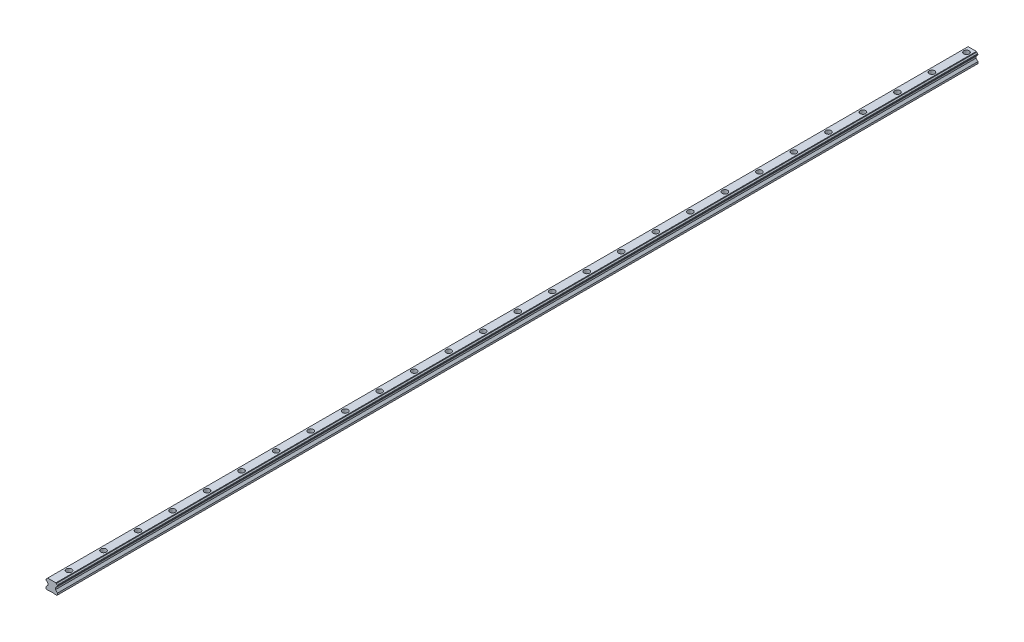
from build123d import *

# Parameters (mm, degrees)
BOSS_EXTRUDE1_DEPTH = 800
LPATTERN1_COUNT     = 27
LPATTERN1_PITCH     = 60


with BuildPart() as part:
    # Sketch1 → Boss-Extrude1 (new, symmetric)
    with BuildSketch(Plane.XY):
        with BuildLine():
            Line((-10, -10.494534492), (-10, -13.49461174))
            Line((-10, -13.49461174), (-9, -14.49461174))
            Line((-9, -14.49461174), (-3, -14.49461174))
            Line((-3, -14.49461174), (-2.5, -13.99461174))
            Line((-2.5, -13.99461174), (2.5, -13.99461174))
            Line((2.5, -13.99461174), (3, -14.49461174))
            Line((3, -14.49461174), (9, -14.49461174))
            Line((9, -14.49461174), (10, -13.49461174))
            Line((10, -13.49461174), (10, -10.494534492))
            Line((10, -10.494534492), (6.550048828, -7.044660568))
            Line((6.550048828, -7.044660568), (6.550048828, -4.115376472))
            Line((6.550048828, -4.115376472), (7.767930373, -2.899480236))
            ThreePointArc((7.767930373, -2.899480236), (8.341068744, -1.762979997), (9.472673258, -1.180235103))
            Line((9.472673258, -1.180235103), (10, -0.665425301))
            Line((10, -0.665425301), (10, 0.665425301))
            Line((10, 0.665425301), (9.472673258, 1.192752043))
            ThreePointArc((9.472673258, 1.192752043), (8.344874488, 1.769695527), (7.767930373, 2.897493974))
            Line((7.767930373, 2.897493974), (7.160036564, 3.50538826))
            Line((7.160036564, 3.50538826), (-7.160036564, 3.50538826))
            Line((-7.160036564, 3.50538826), (-7.767930373, 2.897493974))
            ThreePointArc((-7.767930373, 2.897493974), (-8.344874488, 1.769695527), (-9.472673258, 1.192752043))
            Line((-9.472673258, 1.192752043), (-10, 0.665425301))
            Line((-10, 0.665425301), (-10, -0.665425301))
            Line((-10, -0.665425301), (-9.472673258, -1.180235103))
            ThreePointArc((-9.472673258, -1.180235103), (-8.341068744, -1.762979997), (-7.767930373, -2.899480236))
            Line((-7.767930373, -2.899480236), (-6.550048828, -4.115376472))
            Line((-6.550048828, -4.115376472), (-6.550048828, -7.044660568))
            Line((-6.550048828, -7.044660568), (-10, -10.494534492))
        make_face()
    extrude(amount=BOSS_EXTRUDE1_DEPTH, both=True)

    # Sketch2 → Cut-Revolve1 (revolve, cut)
    with BuildSketch(Plane(origin=(0, 0, 0), x_dir=(0, 0, -1), z_dir=(1, 0, 0))):
        Polygon((-770, 3.50538826), (-770, -14.49461174), (-773, -14.49461174), (-773, -4.99461174), (-774.75, -4.99461174), (-774.75, 3.50538826), align=None)
    cut_revolve1 = revolve(axis=Axis((0, 3.50538826, 770), (0, -1, 0)), mode=Mode.SUBTRACT)

    # LPattern1: Cut-Revolve1 ×27
    with Locations(*[(0, 0, -i * LPATTERN1_PITCH) for i in range(1, LPATTERN1_COUNT)]):
        add(cut_revolve1, mode=Mode.SUBTRACT)


solid = part.part
